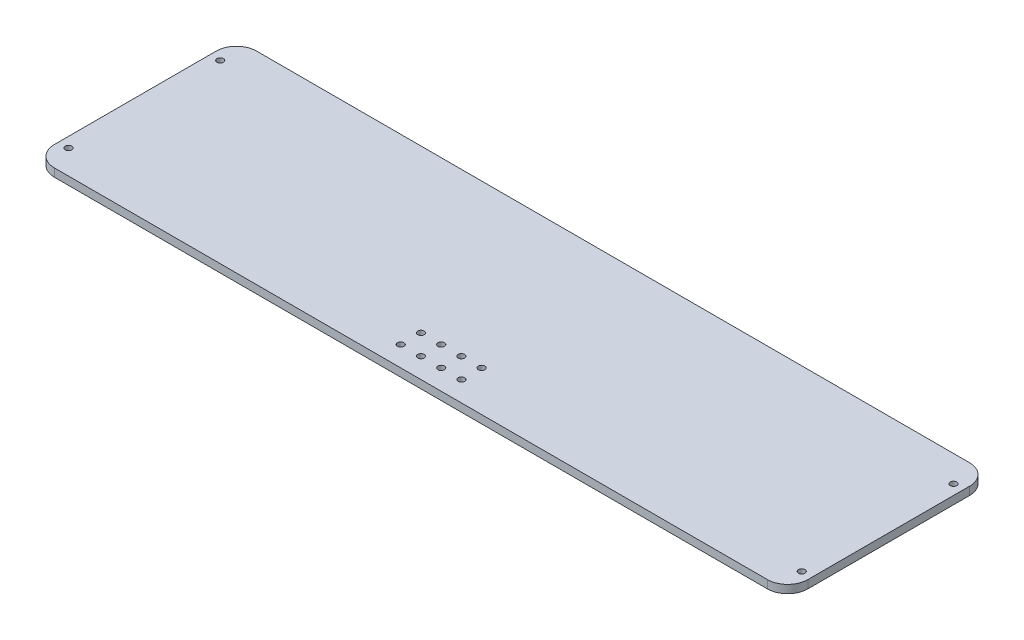
from build123d import *

# Parameters (mm, degrees)
SKETCH_1_R          = 1.6
EXTRUDE_1_DEPTH     = 4
SKETCH_2_R          = 1.6
CUT_EXTRUDE_1_DEPTH = 3


with BuildPart() as part:
    # 草图1 → 凸台-拉伸1 (new body)
    with BuildSketch(Plane(origin=(0, 0, 0), x_dir=(1, 0, 0), z_dir=(0, 1, 0))):
        with BuildLine():
            Line((-176.25, 50), (176.25, 50))
            ThreePointArc((176.25, 50), (183.321067812, 47.071067812), (186.25, 40))
            Line((186.25, 40), (186.25, -40))
            ThreePointArc((186.25, -40), (183.321067812, -47.071067812), (176.25, -50))
            Line((176.25, -50), (-176.25, -50))
            ThreePointArc((-176.25, -50), (-183.321067812, -47.071067812), (-186.25, -40))
            Line((-186.25, -40), (-186.25, 40))
            ThreePointArc((-186.25, 40), (-183.321067812, 47.071067812), (-176.25, 50))
        make_face()
        with Locations(Location((181.25, -38, 0), (0, 0, 270))):
            Circle(SKETCH_1_R, mode=Mode.SUBTRACT)
        with Locations(Location((181.25, 37, 0), (0, 0, 270))):
            Circle(SKETCH_1_R, mode=Mode.SUBTRACT)
        with Locations(Location((-181.25, -38, 0), (0, 0, 90))):
            Circle(SKETCH_1_R, mode=Mode.SUBTRACT)
        with Locations(Location((-181.25, 37, 0), (0, 0, 90))):
            Circle(SKETCH_1_R, mode=Mode.SUBTRACT)
    extrude(amount=EXTRUDE_1_DEPTH)

    # 草图2 → 切除-拉伸1 (cut)
    with BuildSketch(Plane(origin=(0, 4, 0), x_dir=(1, 0, 0), z_dir=(0, 1, 0))):
        with Locations(Location((-15, -30, 0), (0, 0, 270))):
            Circle(SKETCH_2_R)
        with Locations(Location((15, -30, 0), (0, 0, 270))):
            Circle(SKETCH_2_R)
        with Locations(Location((15, -40, 0), (0, 0, 270))):
            Circle(SKETCH_2_R)
        with Locations(Location((-15, -40, 0), (0, 0, 270))):
            Circle(SKETCH_2_R)
        with Locations(Location((-5, -30, 0), (0, 0, 270))):
            Circle(SKETCH_2_R)
        with Locations(Location((5, -30, 0), (0, 0, 270))):
            Circle(SKETCH_2_R)
        with Locations(Location((-5, -40, 0), (0, 0, 270))):
            Circle(SKETCH_2_R)
        with Locations(Location((5, -40, 0), (0, 0, 270))):
            Circle(SKETCH_2_R)
    extrude(amount=-CUT_EXTRUDE_1_DEPTH, mode=Mode.SUBTRACT)


solid = part.part
